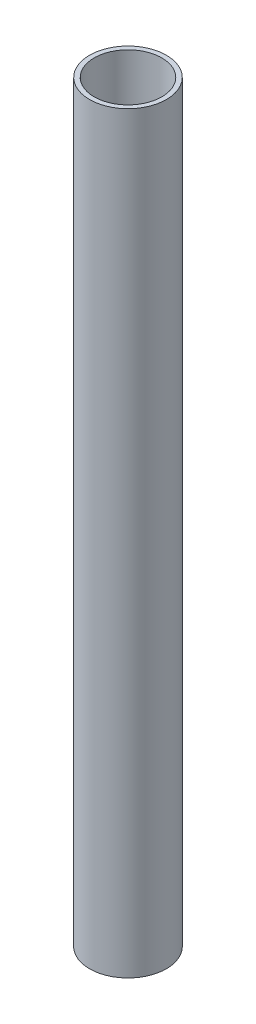
from build123d import *

# Parameters (mm, degrees)
SKETCH_1_R      = 12.5
SKETCH_1_R_2    = 11
EXTRUDE_1_DEPTH = 245


with BuildPart() as part:
    # 草图1 → 凸台-拉伸1 (new body)
    with BuildSketch(Plane(origin=(0, 0, 0), x_dir=(1, 0, 0), z_dir=(0, 1, 0))):
        with Locations(Location((0, 0, 0), (0, 0, 270))):
            Circle(SKETCH_1_R)
        with Locations(Location((0, 0, 0), (0, 0, 270))):
            Circle(SKETCH_1_R_2, mode=Mode.SUBTRACT)
    extrude(amount=EXTRUDE_1_DEPTH)


solid = part.part
